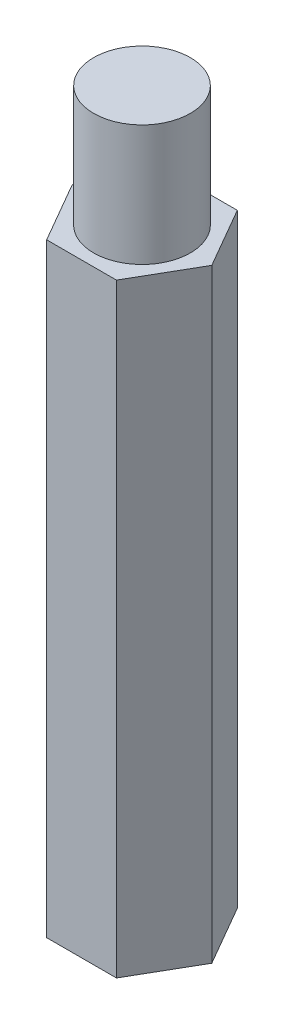
from build123d import *

# Parameters (mm, degrees)
EXTRUDE_1_DEPTH     = 20
SKETCH_2_R          = 1.6
EXTRUDE_2_DEPTH     = 4
SKETCH_3_R          = 1.6
CUT_EXTRUDE_1_DEPTH = 4


with BuildPart() as part:
    # 草图1 → 凸台-拉伸1 (new body)
    with BuildSketch(Plane(origin=(0, 0, 0), x_dir=(1, 0, 0), z_dir=(0, 1, 0))):
        Polygon((1.154700538, -2), (2.309401077, 0), (1.154700538, 2), (-1.154700538, 2), (-2.309401077, 0), (-1.154700538, -2), align=None)
    extrude(amount=EXTRUDE_1_DEPTH)

    # 草图2 → 凸台-拉伸2 (add)
    with BuildSketch(Plane(origin=(0, 20, 0), x_dir=(1, 0, 0), z_dir=(0, 1, 0))):
        with Locations(Location((0, 0, 0), (0, 0, 270))):
            Circle(SKETCH_2_R)
    extrude(amount=EXTRUDE_2_DEPTH)

    # 草图3 → 切除-拉伸1 (cut)
    with BuildSketch(Plane.XZ):
        with Locations(Location((0, 0, 0), (0, 0, 90))):
            Circle(SKETCH_3_R)
    extrude(amount=-CUT_EXTRUDE_1_DEPTH, mode=Mode.SUBTRACT)


solid = part.part
